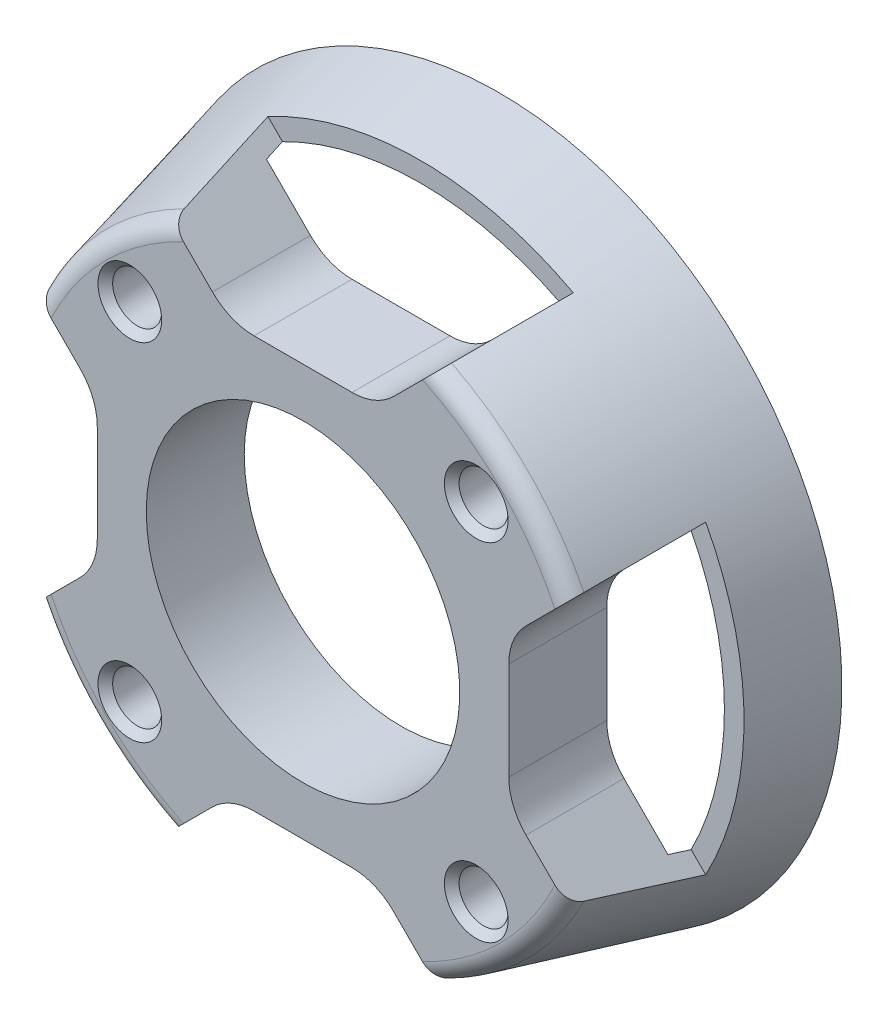
from build123d import *

# Parameters (mm, degrees)
FILLET1_R                       = 1
M3X0_5_TAPPED_HOLE1_D           = 2.5
M3X0_5_TAPPED_HOLE1_CSINK_D     = 3.25
M3X0_5_TAPPED_HOLE1_CSINK_ANGLE = 90
CUT_EXTRUDE1_DEPTH              = 6


with BuildPart() as part:
    # Sketch4 → Revolve1 (revolve)
    with BuildSketch(Plane(origin=(0, 0, 0), x_dir=(0, 0, -1), z_dir=(1, 0, 0)), mode=Mode.PRIVATE) as revolve1_sk:
        Polygon((0, 16.5), (0, 17.5), (-10, 15.006719972), (-10, 8), (-5, 8), (-5, 15.253359986), align=None)
    revolve(revolve1_sk.sketch.rotate(Axis((0, 0, 0), (0, 0, 1)), 90), axis=Axis((0, 0, 0), (0, 0, 1)))

    # Fillet1
    fillet1_edges = [part.edges().sort_by_distance(p)[0] for p in [
        (15.006719972, 0, 10),
    ]]
    fillet(fillet1_edges, radius=FILLET1_R)

    # M3x0.5 Tapped Hole1 (through all)
    with Locations(Plane.XY.offset(10)):
        with Locations((8.838834765, 8.838834765), (-8.838834765, 8.838834765), (-8.838834765, -8.838834765), (8.838834765, -8.838834765)):
            CounterSinkHole(M3X0_5_TAPPED_HOLE1_D / 2, M3X0_5_TAPPED_HOLE1_CSINK_D / 2, counter_sink_angle=M3X0_5_TAPPED_HOLE1_CSINK_ANGLE)

    # Sketch9 → Cut-Extrude1 (cut)
    with BuildSketch(Plane.XY.offset(10)):
        with BuildLine():
            Line((-13.242640687, 20), (-4.621320344, 11.378679656))
            ThreePointArc((-4.621320344, 11.378679656), (-3.648050297, 10.728361402), (-2.5, 10.5))
            Line((-2.5, 10.5), (2.5, 10.5))
            ThreePointArc((2.5, 10.5), (3.648050297, 10.728361402), (4.621320344, 11.378679656))
            Line((4.621320344, 11.378679656), (13.242640687, 20))
            Line((13.242640687, 20), (-13.242640687, 20))
        make_face()
        with BuildLine():
            Line((20, 13.242640687), (11.378679656, 4.621320344))
            ThreePointArc((11.378679656, 4.621320344), (10.728361402, 3.648050297), (10.5, 2.5))
            Line((10.5, 2.5), (10.5, -2.5))
            ThreePointArc((10.5, -2.5), (10.728361402, -3.648050297), (11.378679656, -4.621320344))
            Line((11.378679656, -4.621320344), (20, -13.242640687))
            Line((20, -13.242640687), (20, 13.242640687))
        make_face()
        with BuildLine():
            Line((13.242640687, -20), (4.621320344, -11.378679656))
            ThreePointArc((4.621320344, -11.378679656), (3.648050297, -10.728361402), (2.5, -10.5))
            Line((2.5, -10.5), (-2.5, -10.5))
            ThreePointArc((-2.5, -10.5), (-3.648050297, -10.728361402), (-4.621320344, -11.378679656))
            Line((-4.621320344, -11.378679656), (-13.242640687, -20))
            Line((-13.242640687, -20), (13.242640687, -20))
        make_face()
        with BuildLine():
            Line((-20, -13.242640687), (-11.378679656, -4.621320344))
            ThreePointArc((-11.378679656, -4.621320344), (-10.728361402, -3.648050297), (-10.5, -2.5))
            Line((-10.5, -2.5), (-10.5, 2.5))
            ThreePointArc((-10.5, 2.5), (-10.728361402, 3.648050297), (-11.378679656, 4.621320344))
            Line((-11.378679656, 4.621320344), (-20, 13.242640687))
            Line((-20, 13.242640687), (-20, -13.242640687))
        make_face()
    extrude(amount=-CUT_EXTRUDE1_DEPTH, mode=Mode.SUBTRACT)


solid = part.part
